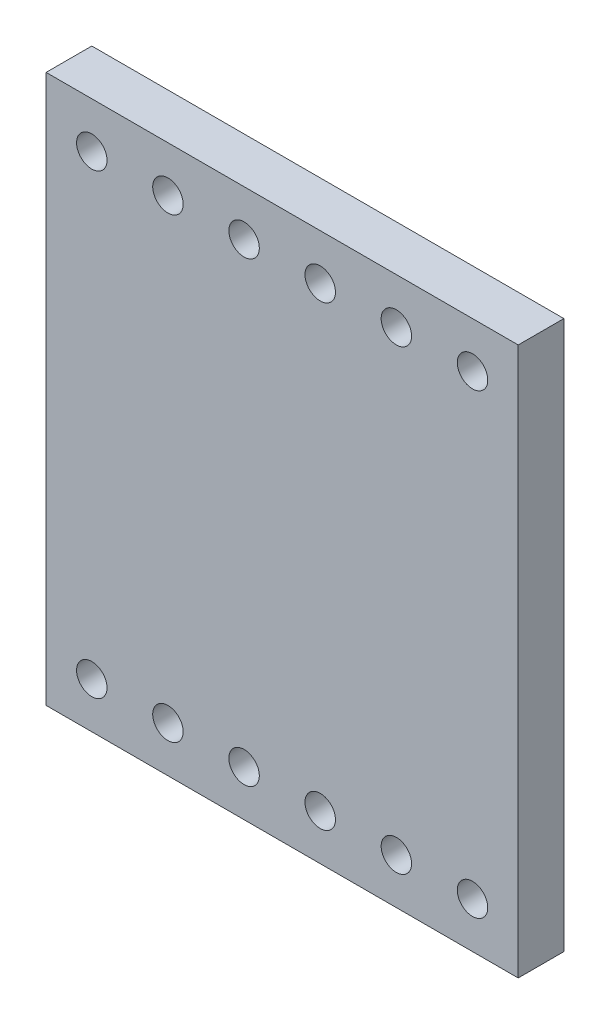
from build123d import *

# Parameters (mm, degrees)
SKETCH1_W           = 18
SKETCH1_H           = 15.5
BOSS_EXTRUDE1_DEPTH = 0.75
SKETCH2_R           = 0.5
CUT_EXTRUDE1_DEPTH  = 1.5


with BuildPart() as part:
    # Sketch1 → Boss-Extrude1 (new, symmetric)
    with BuildSketch(Plane(origin=(0, 0, 0), x_dir=(0, 1, 0), z_dir=(0, 0, 1))):
        Rectangle(SKETCH1_W, SKETCH1_H)
    extrude(amount=BOSS_EXTRUDE1_DEPTH, both=True)

    # Sketch2 → Cut-Extrude1 (cut)
    with BuildSketch(Plane.XY.offset(0.75)):
        with Locations((-6.25, -7.5)):
            Circle(SKETCH2_R)
        with Locations((-3.75, -7.5)):
            Circle(SKETCH2_R)
        with Locations((-1.25, -7.5)):
            Circle(SKETCH2_R)
        with Locations((1.25, -7.5)):
            Circle(SKETCH2_R)
        with Locations((3.75, -7.5)):
            Circle(SKETCH2_R)
        with Locations((6.25, -7.5)):
            Circle(SKETCH2_R)
    cut_extrude1 = extrude(amount=-CUT_EXTRUDE1_DEPTH, mode=Mode.SUBTRACT)

    # Mirror1: Cut-Extrude1 across plane
    add(cut_extrude1.mirror(Plane.ZX), mode=Mode.SUBTRACT)


solid = part.part
